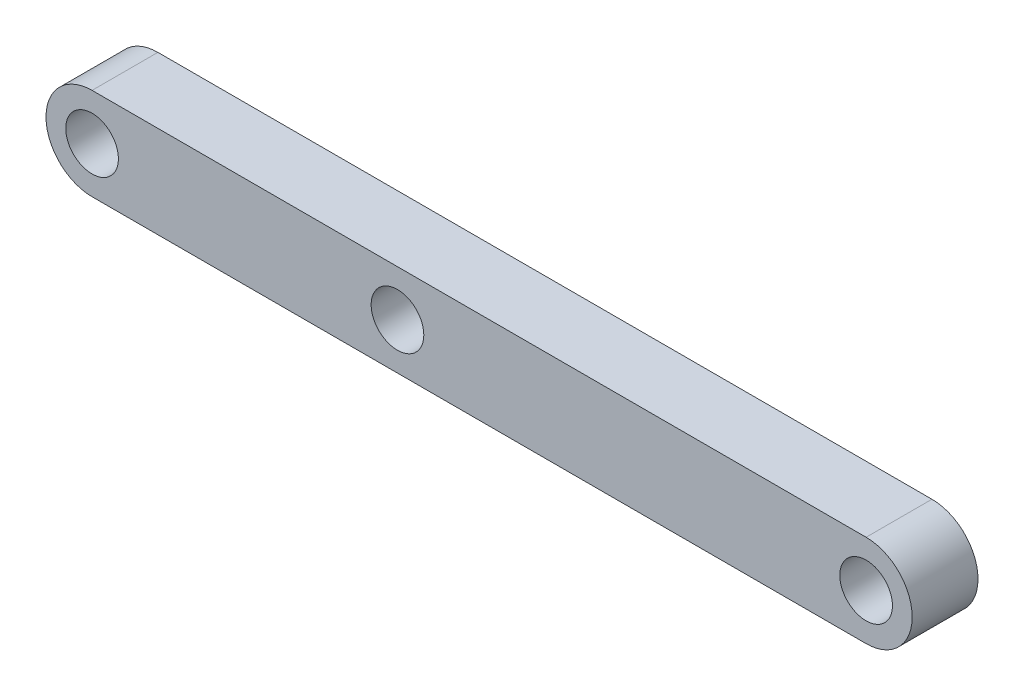
from build123d import *

# Parameters (mm, degrees)
SKETCH_1_R      = 20
EXTRUDE_1_DEPTH = 50


with BuildPart() as part:
    # 草图1 → 凸台-拉伸1 (new body)
    with BuildSketch(Plane.XY):
        with BuildLine():
            Line((0, 35), (588, 35))
            ThreePointArc((588, 35), (623, 0), (588, -35))
            Line((588, -35), (0, -35))
            ThreePointArc((0, -35), (-35, 0), (0, 35))
        make_face()
        Circle(SKETCH_1_R, mode=Mode.SUBTRACT)
        with Locations((232, 0)):
            Circle(SKETCH_1_R, mode=Mode.SUBTRACT)
        with Locations((588, 0)):
            Circle(SKETCH_1_R, mode=Mode.SUBTRACT)
    extrude(amount=EXTRUDE_1_DEPTH)


solid = part.part
